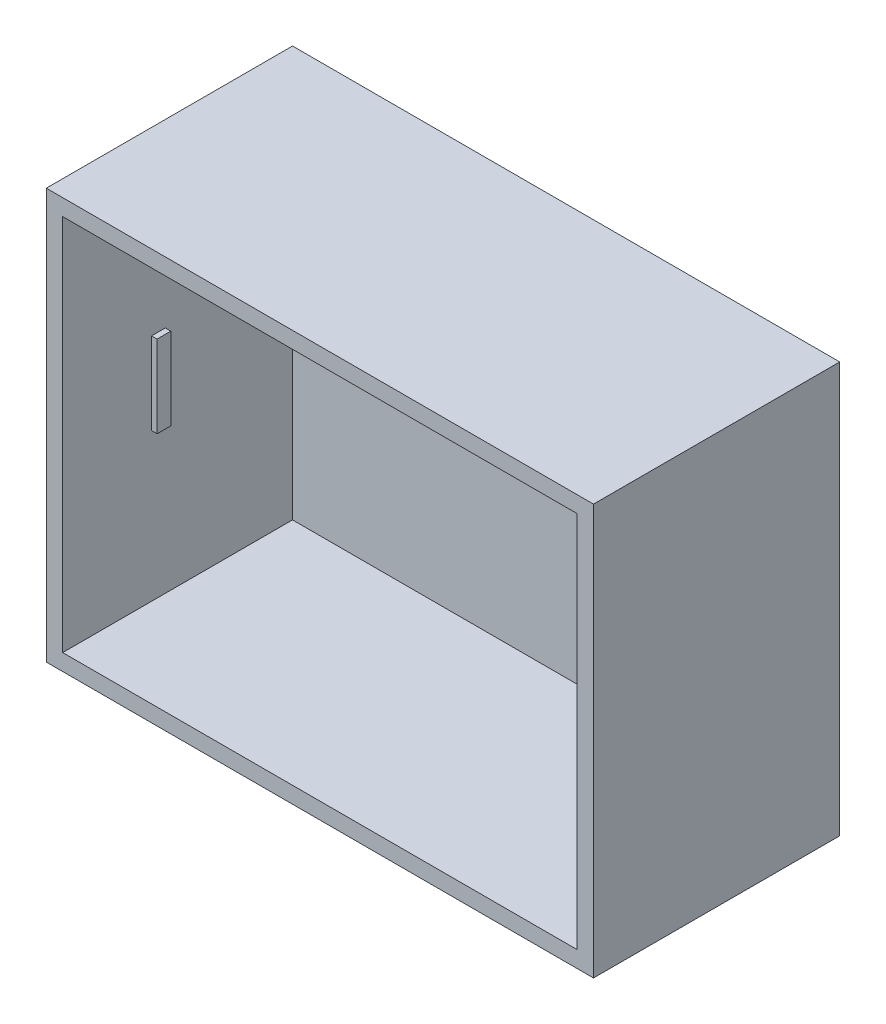
from build123d import *

# Parameters (mm, degrees)
SKETCH2_W         = 80
SKETCH2_H         = 60
FLOOR_2P4_DEPTH   = 2.4
WALLS_2P4_START   = 2.4
SKETCH3_W         = 80
SKETCH3_H         = 60
SKETCH3_W_2       = 75.2
SKETCH3_H_2       = 55.2
WALLS_2P4_DEPTH   = 33.6
CATCH_LEFT_START  = 21
SKETCH4_W         = 0.8
SKETCH4_H         = 12
CATCH_LEFT_DEPTH  = 2
CATCH_RIGHT_START = 21
SKETCH5_W         = 0.8
SKETCH5_H         = 12
CATCH_RIGHT_DEPTH = 2


with BuildPart() as part:
    # Sketch2 → Floor_2p4 (new body)
    with BuildSketch(Plane.XY):
        Rectangle(SKETCH2_W, SKETCH2_H)
    extrude(amount=FLOOR_2P4_DEPTH)

    # Sketch3 → Walls_2p4 (add)
    with BuildSketch(Plane.XY.offset(WALLS_2P4_START)):
        Rectangle(SKETCH3_W, SKETCH3_H)
        Rectangle(SKETCH3_W_2, SKETCH3_H_2, mode=Mode.SUBTRACT)
    extrude(amount=WALLS_2P4_DEPTH)

    # Sketch4 → Catch_left (add)
    with BuildSketch(Plane.XY.offset(CATCH_LEFT_START)):
        with Locations((-37.2, 0)):
            Rectangle(SKETCH4_W, SKETCH4_H)
    extrude(amount=CATCH_LEFT_DEPTH)

    # Sketch5 → Catch_right (add)
    with BuildSketch(Plane.XY.offset(CATCH_RIGHT_START)):
        with Locations((37.2, 0)):
            Rectangle(SKETCH5_W, SKETCH5_H)
    extrude(amount=CATCH_RIGHT_DEPTH)


solid = part.part
